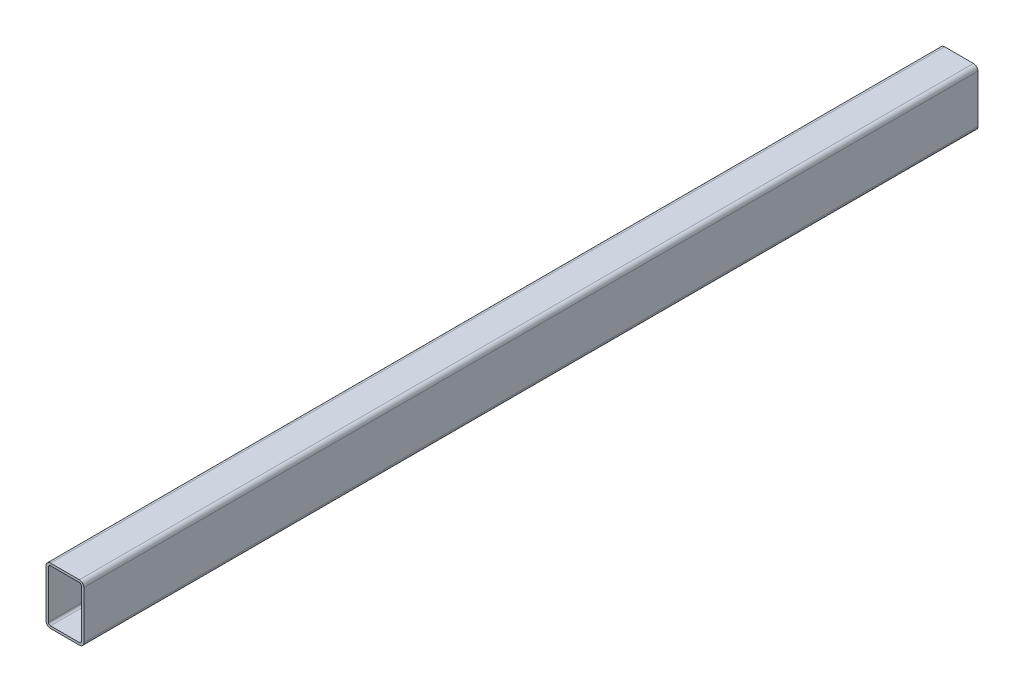
from build123d import *

# Parameters (mm, degrees)
BOSS_EXTRUDE1_DEPTH = 600.8


with BuildPart() as part:
    # Sketch1 → Boss-Extrude1 (new, symmetric)
    with BuildSketch(Plane.XY):
        with BuildLine():
            Line((19.4, -38.1), (-19.4, -38.1))
            ThreePointArc((-19.4, -38.1), (-23.642640687, -36.342640687), (-25.4, -32.1))
            Line((-25.4, -32.1), (-25.4, 32.1))
            ThreePointArc((-25.4, 32.1), (-23.642640687, 36.342640687), (-19.4, 38.1))
            Line((-19.4, 38.1), (19.4, 38.1))
            ThreePointArc((19.4, 38.1), (23.642640687, 36.342640687), (25.4, 32.1))
            Line((25.4, 32.1), (25.4, -32.1))
            ThreePointArc((25.4, -32.1), (23.642640687, -36.342640687), (19.4, -38.1))
        make_face()
        with BuildLine():
            Line((19.4, 34.925), (-19.4, 34.925))
            ThreePointArc((-19.4, 34.925), (-21.397576657, 34.097576657), (-22.225, 32.1))
            Line((-22.225, 32.1), (-22.225, -32.1))
            ThreePointArc((-22.225, -32.1), (-21.397576657, -34.097576657), (-19.4, -34.925))
            Line((-19.4, -34.925), (19.4, -34.925))
            ThreePointArc((19.4, -34.925), (21.397576657, -34.097576657), (22.225, -32.1))
            Line((22.225, -32.1), (22.225, 32.1))
            ThreePointArc((22.225, 32.1), (21.397576657, 34.097576657), (19.4, 34.925))
        make_face(mode=Mode.SUBTRACT)
    extrude(amount=BOSS_EXTRUDE1_DEPTH, both=True)


solid = part.part
